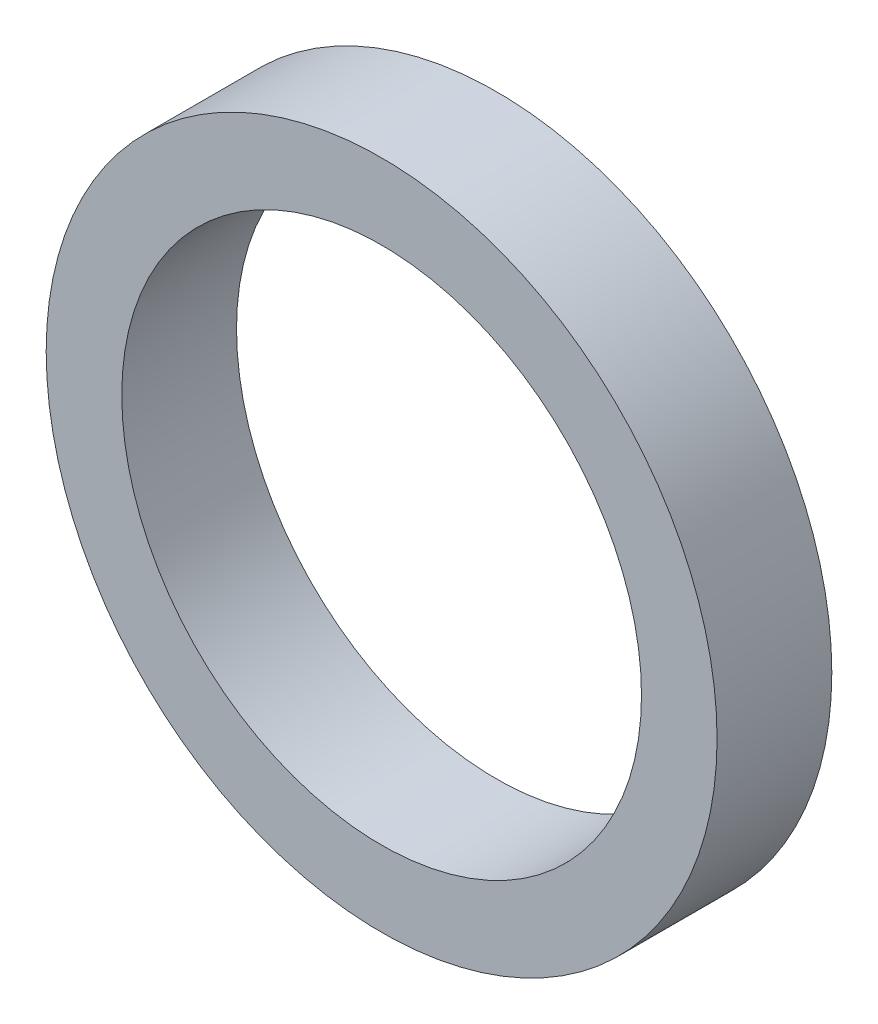
from build123d import *

# Parameters (mm, degrees)
BOSS_EXTRUDE1_DEPTH      = 47.478441
BOSS_EXTRUDE1_DEPTH_BACK = 47.788854
SKETCH1_R                = 278.5
SKETCH1_R_2              = 215.748780306


with BuildPart() as part:
    # Sketch1 → Boss-Extrude1 (new, two sides: drawn at the far end of the back side and taken through both)
    with BuildSketch(Plane.XY.offset(-BOSS_EXTRUDE1_DEPTH_BACK)):
        Circle(SKETCH1_R)
        Circle(SKETCH1_R_2, mode=Mode.SUBTRACT)
    extrude(amount=BOSS_EXTRUDE1_DEPTH + BOSS_EXTRUDE1_DEPTH_BACK)


solid = part.part
